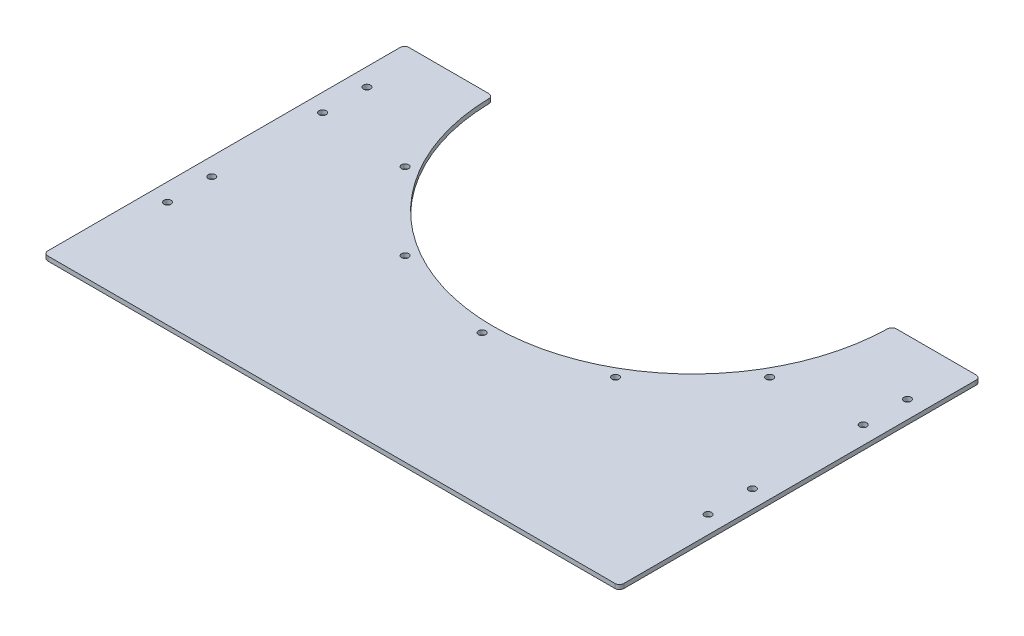
from build123d import *

# Parameters (mm, degrees)
SKETCH_1_R      = 1.6
EXTRUDE_1_DEPTH = 2
FILLET_1_R      = 2


with BuildPart() as part:
    # 草图1 → 凸台-拉伸1 (new body)
    with BuildSketch(Plane(origin=(0, 0, 0), x_dir=(1, 0, 0), z_dir=(0, 1, 0))):
        with BuildLine():
            Line((-130, -81.5), (130, -81.5))
            Line((130, -81.5), (130, 81.5))
            Line((130, 81.5), (90, 81.5))
            ThreePointArc((90, 81.5), (0, -8.5), (-90, 81.5))
            Line((-90, 81.5), (-130, 81.5))
            Line((-130, 81.5), (-130, -81.5))
        make_face()
        with Locations(Location((-122, -33.5, 0), (0, 0, 270))):
            Circle(SKETCH_1_R, mode=Mode.SUBTRACT)
        with Locations(Location((-122, -13.5, 0), (0, 0, 270))):
            Circle(SKETCH_1_R, mode=Mode.SUBTRACT)
        with Locations(Location((-122, 36.5, 0), (0, 0, 270))):
            Circle(SKETCH_1_R, mode=Mode.SUBTRACT)
        with Locations(Location((-82.27241336, 34, 0), (0, 0, 270))):
            Circle(SKETCH_1_R, mode=Mode.SUBTRACT)
        with Locations(Location((-47.5, -0.77241336, 0), (0, 0, 270))):
            Circle(SKETCH_1_R, mode=Mode.SUBTRACT)
        with Locations(Location((122, -33.5, 0), (0, 0, 270))):
            Circle(SKETCH_1_R, mode=Mode.SUBTRACT)
        with Locations(Location((0, -13.5, 0), (0, 0, 270))):
            Circle(SKETCH_1_R, mode=Mode.SUBTRACT)
        with Locations(Location((47.5, -0.77241336, 0), (0, 0, 270))):
            Circle(SKETCH_1_R, mode=Mode.SUBTRACT)
        with Locations(Location((122, -13.5, 0), (0, 0, 270))):
            Circle(SKETCH_1_R, mode=Mode.SUBTRACT)
        with Locations(Location((82.27241336, 34, 0), (0, 0, 270))):
            Circle(SKETCH_1_R, mode=Mode.SUBTRACT)
        with Locations(Location((122, 36.5, 0), (0, 0, 270))):
            Circle(SKETCH_1_R, mode=Mode.SUBTRACT)
        with Locations(Location((-122, 56.5, 0), (0, 0, 270))):
            Circle(SKETCH_1_R, mode=Mode.SUBTRACT)
        with Locations(Location((122, 56.5, 0), (0, 0, 270))):
            Circle(SKETCH_1_R, mode=Mode.SUBTRACT)
    extrude(amount=EXTRUDE_1_DEPTH)

    # 圆角1
    fillet_1_edges = [part.edges().sort_by_distance(p)[0] for p in [
        (90, 1, -81.5),
        (130, 1, -81.5),
        (130, 1, 81.5),
        (-130, 1, 81.5),
        (-130, 1, -81.5),
        (-90, 1, -81.5),
    ]]
    fillet(fillet_1_edges, radius=FILLET_1_R)


solid = part.part
